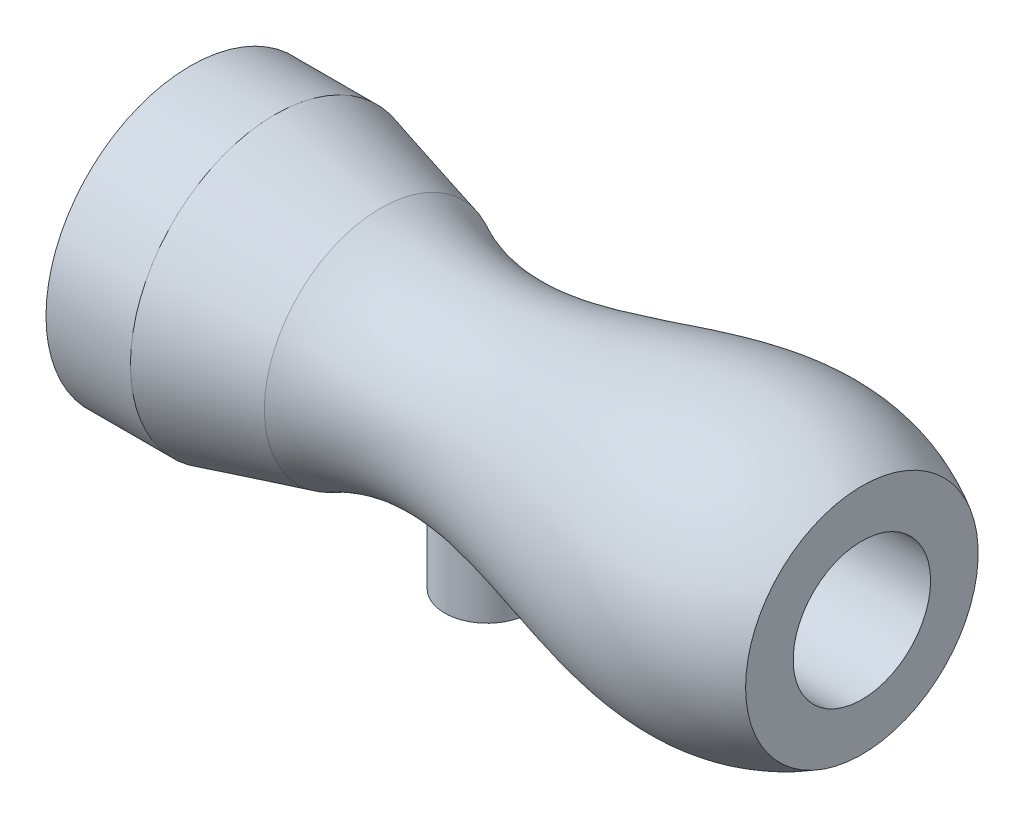
from build123d import *

# Parameters (mm, degrees)
SKETCH_2_R           = 34.370841625
CUT_EXTRUDE_1_DEPTH  = 230
EXTRUDE_1_DEPTH      = 33
EXTRUDE_1_DEPTH_BACK = 10
SKETCH_3_R           = 21.25
SKETCH_3_R_2         = 11.25
SKETCH_4_R           = 72.26496
EXTRUDE_1_2_DEPTH    = 27


with BuildPart() as part:
    # 草圖1 → 旋轉1 (revolve)
    with BuildSketch(Plane.XY, mode=Mode.PRIVATE) as revolve_1_sk:
        with BuildLine():
            Line((0, 0), (0, 72.26496))
            Line((0, 72.26496), (15.231045419, 72.26496))
            Line((15.231045419, 72.26496), (68.107845419, 58.16448))
            add(Edge.make_bspline(
                [(68.107845419, 58.16448), (147.660376362, 17.815554571), (226.419832208, 105.291746385), (308.823182562, 58.16448)],
                knots=[0, 0, 0, 0, 1, 1, 1, 1], degree=3))
            Line((308.823182562, 58.16448), (308.823182562, 0))
            Line((308.823182562, 0), (0, 0))
        make_face()
    revolve(revolve_1_sk.sketch.rotate(Axis((0, 0, 0), (1, 0, 0)), 90), axis=Axis((0, 0, 0), (1, 0, 0)))

    # 草圖2 → 除料-伸長1 (cut)
    with BuildSketch(Plane(origin=(308.823182562, 0, 0), x_dir=(0, 0, -1), z_dir=(1, 0, 0))):
        Circle(SKETCH_2_R)
    extrude(amount=-CUT_EXTRUDE_1_DEPTH, mode=Mode.SUBTRACT)

    # 草圖3 → Extrude 1 (add, two sides: drawn at the far end of the back side and taken through both)
    with BuildSketch(Plane(origin=(0, -70, 0), x_dir=(1, 0, 0), z_dir=(0, 1, 0)).offset(-EXTRUDE_1_DEPTH_BACK)):
        with Locations((121.401340983, 0)):
            Circle(SKETCH_3_R)
        with Locations((121.401340983, 0)):
            Circle(SKETCH_3_R_2, mode=Mode.SUBTRACT)
    extrude(amount=EXTRUDE_1_DEPTH + EXTRUDE_1_DEPTH_BACK)

    # 草圖4 → Extrude 1 2 (add)
    with BuildSketch(Plane.ZY):
        Circle(SKETCH_4_R)
    extrude(amount=EXTRUDE_1_2_DEPTH)


solid = part.part
